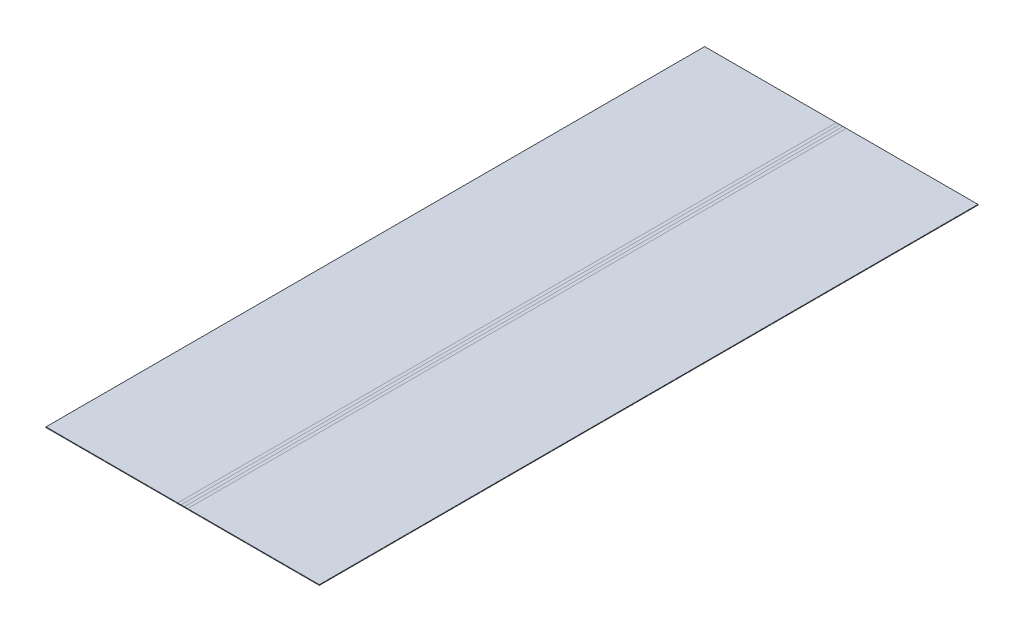
from build123d import *

# Parameters (mm, degrees)
ESQUISSE1_W          = 50
ESQUISSE1_H          = 10000
BOSS_EXTRU_2_DEPTH   = 10
ESQUISSE1_4_W        = 50
ESQUISSE1_4_H        = 10000
BOSS_EXTRU_3_DEPTH   = 10
BOSS_EXTRU_3_2_DEPTH = 10
ESQUISSE1_5_W        = 2000
ESQUISSE1_5_H        = 10000
BOSS_EXTRU_4_DEPTH   = 10
BOSS_EXTRU_4_2_DEPTH = 10


with BuildPart() as part:
    # Esquisse1 → Boss.-Extru.2 (new body)
    with BuildSketch(Plane(origin=(0, 0, 0), x_dir=(1, 0, 0), z_dir=(0, 1, 0))):
        Rectangle(ESQUISSE1_W, ESQUISSE1_H)
    extrude(amount=BOSS_EXTRU_2_DEPTH)


with BuildPart() as body_2:
    # Esquisse1<4> → Boss.-Extru.3 (new body)
    with BuildSketch(Plane(origin=(0, 0, 0), x_dir=(1, 0, 0), z_dir=(0, 1, 0))):
        with Locations((-50, 0)):
            Rectangle(ESQUISSE1_4_W, ESQUISSE1_4_H)
    extrude(amount=BOSS_EXTRU_3_DEPTH)


with BuildPart() as body_3:
    # Esquisse1<4> → Boss.-Extru.3 2 (new body)
    with BuildSketch(Plane(origin=(0, 0, 0), x_dir=(1, 0, 0), z_dir=(0, 1, 0))):
        with Locations((50, 0)):
            Rectangle(ESQUISSE1_4_W, ESQUISSE1_4_H)
    extrude(amount=BOSS_EXTRU_3_2_DEPTH)


with BuildPart() as body_4:
    # Esquisse1<5> → Boss.-Extru.4 (new body)
    with BuildSketch(Plane(origin=(0, 0, 0), x_dir=(1, 0, 0), z_dir=(0, 1, 0))):
        with Locations((-1075, 0)):
            Rectangle(ESQUISSE1_5_W, ESQUISSE1_5_H)
    extrude(amount=BOSS_EXTRU_4_DEPTH)


with BuildPart() as body_5:
    # Esquisse1<5> → Boss.-Extru.4 2 (new body)
    with BuildSketch(Plane(origin=(0, 0, 0), x_dir=(1, 0, 0), z_dir=(0, 1, 0))):
        with Locations((1075, 0)):
            Rectangle(ESQUISSE1_5_W, ESQUISSE1_5_H)
    extrude(amount=BOSS_EXTRU_4_2_DEPTH)


solid = Compound([part.part, body_2.part, body_3.part, body_4.part, body_5.part])
